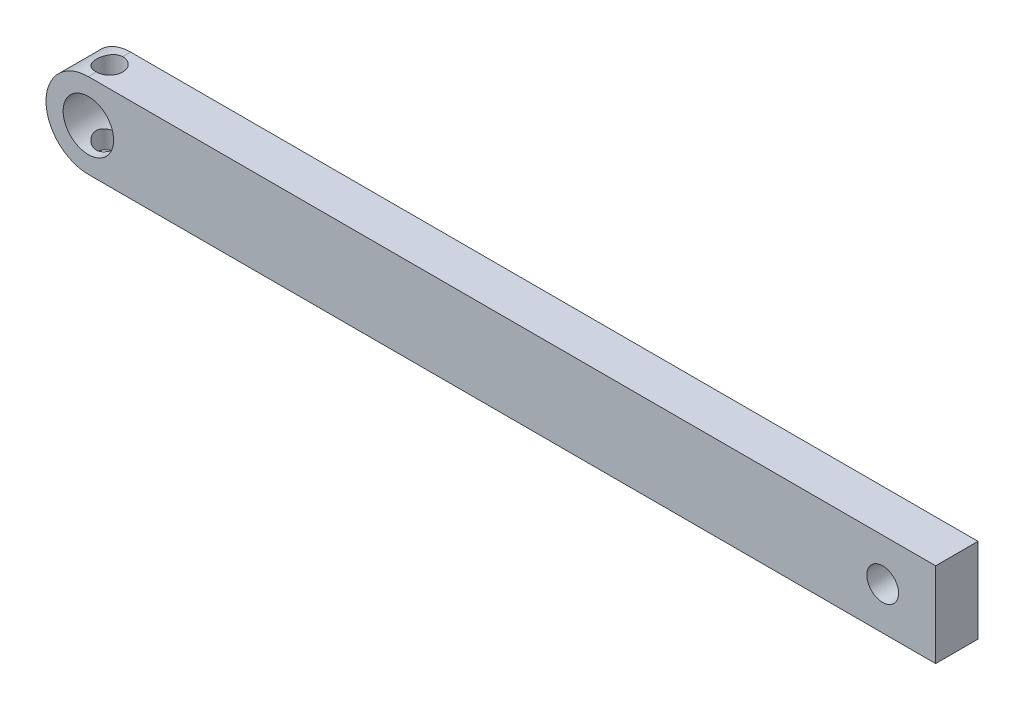
from build123d import *

# Parameters (mm, degrees)
BOSS_EXTRUDE1_DEPTH = 8
SKETCH2_R           = 4.7625
SKETCH2_R_2         = 3
CUT_EXTRUDE1_DEPTH  = 20
SKETCH3_R           = 4
CUT_EXTRUDE2_DEPTH  = 0.5
SKETCH4_R           = 2.5
CUT_EXTRUDE3_DEPTH  = 20


with BuildPart() as part:
    # Sketch1 → Boss-Extrude1 (new body)
    with BuildSketch(Plane.XY):
        with BuildLine():
            Line((0, -8), (160, -8))
            Line((160, -8), (160, 8))
            Line((160, 8), (0, 8))
            ThreePointArc((0, 8), (-8, 0), (0, -8))
        make_face()
    extrude(amount=BOSS_EXTRUDE1_DEPTH)

    # Sketch2 → Cut-Extrude1 (cut, symmetric)
    with BuildSketch(Plane.XY):
        Circle(SKETCH2_R)
        with Locations((150, 0)):
            Circle(SKETCH2_R_2)
    extrude(amount=CUT_EXTRUDE1_DEPTH, both=True, mode=Mode.SUBTRACT)

    # Sketch3 → Cut-Extrude2 (cut, symmetric)
    with BuildSketch(Plane.XY):
        with Locations((30, 0)):
            Circle(SKETCH3_R)
    extrude(amount=CUT_EXTRUDE2_DEPTH, both=True, mode=Mode.SUBTRACT)

    # Sketch4 → Cut-Extrude3 (cut, symmetric)
    with BuildSketch(Plane(origin=(0, 0, 0), x_dir=(1, 0, 0), z_dir=(0, 1, 0))):
        with Locations((0, -4)):
            Circle(SKETCH4_R)
    extrude(amount=CUT_EXTRUDE3_DEPTH, both=True, mode=Mode.SUBTRACT)


solid = part.part
